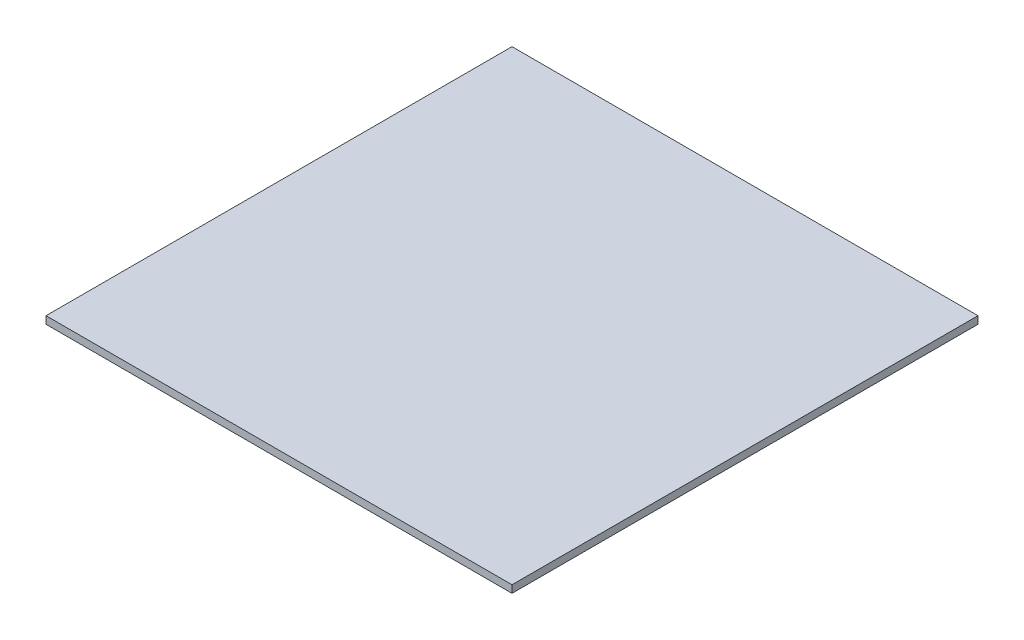
from build123d import *

# Parameters (mm, degrees)
SKETCH1_W           = 100
SKETCH1_H           = 100
BOSS_EXTRUDE1_DEPTH = 1.6


with BuildPart() as part:
    # Sketch1 → Boss-Extrude1 (new body)
    with BuildSketch(Plane(origin=(0, 0, 0), x_dir=(1, 0, 0), z_dir=(0, 1, 0))):
        Rectangle(SKETCH1_W, SKETCH1_H)
    extrude(amount=BOSS_EXTRUDE1_DEPTH)


solid = part.part
